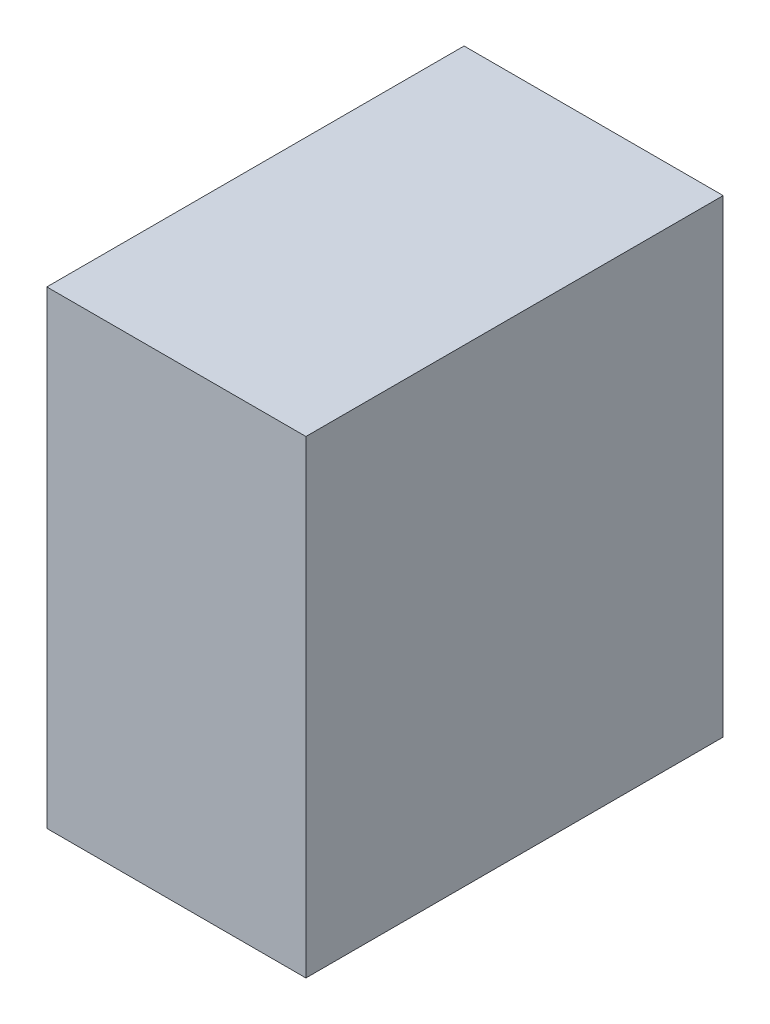
from build123d import *

# Parameters (mm, degrees)
SKETCH1_W           = 153
SKETCH1_H           = 134.8
BOSS_EXTRUDE1_DEPTH = 85.2
SHELL1_T            = -1.5
SKETCH2_W           = 85.2
SKETCH2_H           = 134.8
CUT_EXTRUDE1_DEPTH  = 1.5
SKETCH3_W           = 151.5
SKETCH3_H           = 134.8
CUT_EXTRUDE2_DEPTH  = 1.5


with BuildPart() as part:
    # Sketch1 → Boss-Extrude1 (new body)
    with BuildSketch(Plane.YZ):
        with Locations((76.5, 67.4)):
            Rectangle(SKETCH1_W, SKETCH1_H)
    extrude(amount=BOSS_EXTRUDE1_DEPTH)

    # Shell1
    shell1_openings = [part.faces().sort_by_distance(p)[0] for p in [
        (42.6, 76.5, 0),
    ]]
    offset(amount=SHELL1_T, openings=shell1_openings, kind=Kind.INTERSECTION)

    # Sketch2 → Cut-Extrude1 (cut)
    with BuildSketch(Plane.XZ):
        with Locations((42.6, 67.4)):
            Rectangle(SKETCH2_W, SKETCH2_H)
    extrude(amount=-CUT_EXTRUDE1_DEPTH, mode=Mode.SUBTRACT)

    # Sketch3 → Cut-Extrude2 (cut)
    with BuildSketch(Plane(origin=(0, 0, 0), x_dir=(0, -1, 0), z_dir=(-1, 0, 0))):
        with Locations((-77.25, 67.4)):
            Rectangle(SKETCH3_W, SKETCH3_H)
    extrude(amount=-CUT_EXTRUDE2_DEPTH, mode=Mode.SUBTRACT)


solid = part.part
